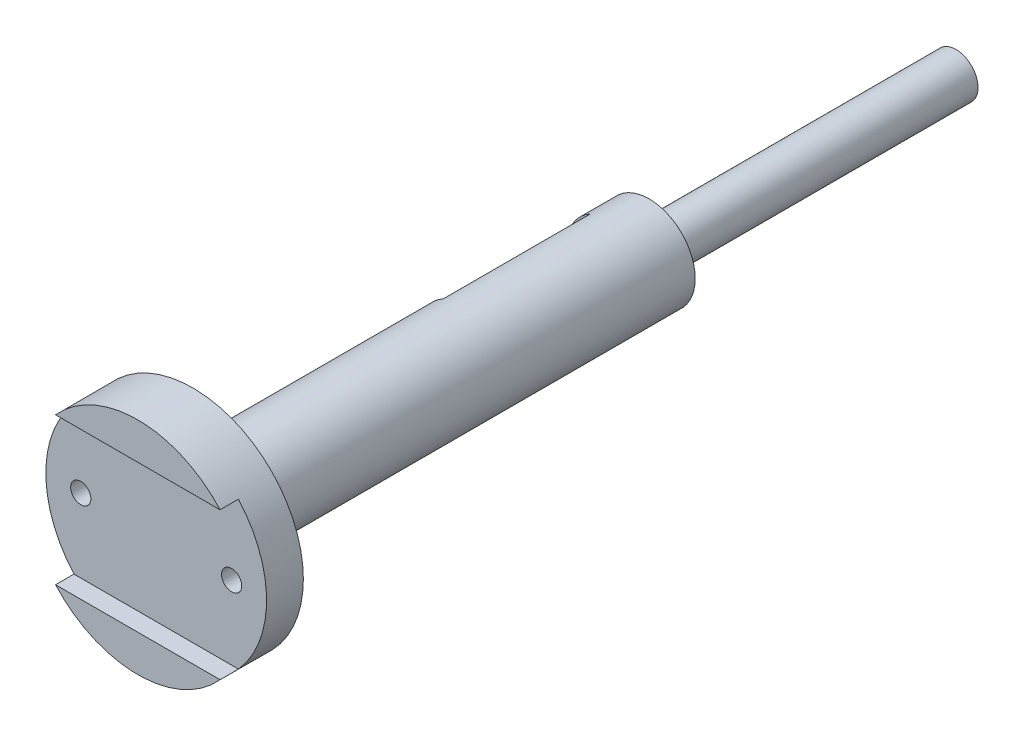
from build123d import *

# Parameters (mm, degrees)
ESQUISSE1_R                                = 30
BOSS_EXTRU_1_DEPTH                         = 15
ESQUISSE2_R                                = 12.5
BOSS_EXTRU_2_DEPTH                         = 124
ESQUISSE4_2_W                              = 230
ESQUISSE4_2_H                              = 40
ENL_V_MAT_EXTRU_1_DEPTH                    = 5
CHAMBRAGE_POUR_VIS_T_TE_HEXAGONALE_2_COUNT = 2
CHAMBRAGE_POUR_VIS_T_TE_HEXAGONALE_2_PITCH = 41
ESQUISSE17_R                               = 6
BOSS_EXTRU_4_DEPTH                         = 83.38
ESQUISSE18_W                               = 10.356322474
ESQUISSE18_H                               = 3
ENL_V_MAT_EXTRU_2_DEPTH                    = 3
ESQUISSE19_W                               = 7.933443835
ESQUISSE19_H                               = 21.9317122
ENL_V_MAT_EXTRU_3_DEPTH                    = 50
BOSS_EXTRU_6_START                         = -10
ESQUISSE21_R                               = 12.5
BOSS_EXTRU_6_DEPTH                         = 10
D_GAGEMENT_M41_D                           = 4.5
D_GAGEMENT_M41_DEPTH                       = 3
D_GAGEMENT_M41_TIP                         = 1.299038106


with BuildPart() as part:
    # Esquisse1 → Boss.-Extru.1 (new body)
    with BuildSketch(Plane.XY):
        Circle(ESQUISSE1_R)
    extrude(amount=BOSS_EXTRU_1_DEPTH)

    # Esquisse2 → Boss.-Extru.2 (add)
    with BuildSketch(Plane(origin=(0, 0, 0), x_dir=(-1, 0, 0), z_dir=(0, 0, -1))):
        with Locations(Location((0, 0, 0), (0, 0, 180))):
            Circle(ESQUISSE2_R)
    extrude(amount=BOSS_EXTRU_2_DEPTH)

    # Esquisse4<2> → Enlèv. mat.-Extru.1 (cut)
    with BuildSketch(Plane.XY.offset(15)):
        Rectangle(ESQUISSE4_2_W, ESQUISSE4_2_H)
    extrude(amount=-ENL_V_MAT_EXTRU_1_DEPTH, mode=Mode.SUBTRACT)

    # Esquisse14 → Chambrage pour vis à tête hexagonale M51 (revolve, cut)
    with BuildSketch(Plane.YZ.offset(-20.5)):
        Polygon((0, 0), (0, 15), (2.75, 15), (2.75, 3.605), (2.775, 3.58), (6.12, 3.58), (6.12, 0), align=None)
    chambrage_pour_vis_t_te_hexagonale_m51 = revolve(axis=Axis((-20.5, 0, -6.35), (0, 0, 1)), mode=Mode.SUBTRACT)

    # Chambrage pour vis _ t_te hexagonale 2: Chambrage pour vis à tête hexagonale M51 ×2
    with Locations(*[(i * CHAMBRAGE_POUR_VIS_T_TE_HEXAGONALE_2_PITCH, 0, 0) for i in range(1, CHAMBRAGE_POUR_VIS_T_TE_HEXAGONALE_2_COUNT)]):
        add(chambrage_pour_vis_t_te_hexagonale_m51, mode=Mode.SUBTRACT)

    # Esquisse17 → Boss.-Extru.4 (add)
    with BuildSketch(Plane(origin=(0, 0, -124), x_dir=(-1, 0, 0), z_dir=(0, 0, -1))):
        Circle(ESQUISSE17_R)
    extrude(amount=BOSS_EXTRU_4_DEPTH)

    # Esquisse18 → Enlèv. mat.-Extru.2 (cut)
    with BuildSketch(Plane(origin=(0, 0, -207.38), x_dir=(-1, 0, 0), z_dir=(0, 0, -1))):
        with Locations((1.787207702, 0)):
            Rectangle(ESQUISSE18_W, ESQUISSE18_H)
    extrude(amount=-ENL_V_MAT_EXTRU_2_DEPTH, mode=Mode.SUBTRACT)

    # Esquisse19 → Enlèv. mat.-Extru.3 (cut)
    with BuildSketch(Plane(origin=(0, 0, -124), x_dir=(-1, 0, 0), z_dir=(0, 0, -1))):
        with Locations((9.966721917, 0)):
            Rectangle(ESQUISSE19_W, ESQUISSE19_H)
    extrude(amount=-ENL_V_MAT_EXTRU_3_DEPTH, mode=Mode.SUBTRACT)

    # Esquisse21 → Boss.-Extru.6 (add)
    with BuildSketch(Plane(origin=(0, 0, -124), x_dir=(-1, 0, 0), z_dir=(0, 0, -1)).offset(BOSS_EXTRU_6_START)):
        with Locations(Location((0, 0, 0), (0, 0, 180))):
            Circle(ESQUISSE21_R)
    extrude(amount=BOSS_EXTRU_6_DEPTH)

    # Dégagement M41
    with Locations(Plane.ZY.offset(6)):
        with Locations((-82.1, 5.85067254), (-93.1, -2.14932746), (-93.1, 5.85067254), (-104.1, 5.85067254)):
            Hole(D_GAGEMENT_M41_D / 2, depth=D_GAGEMENT_M41_DEPTH)
            with Locations((0, 0, -(D_GAGEMENT_M41_DEPTH + D_GAGEMENT_M41_TIP / 2))):  # 120° drill point
                Cone(0, D_GAGEMENT_M41_D / 2, D_GAGEMENT_M41_TIP, mode=Mode.SUBTRACT)


solid = part.part
